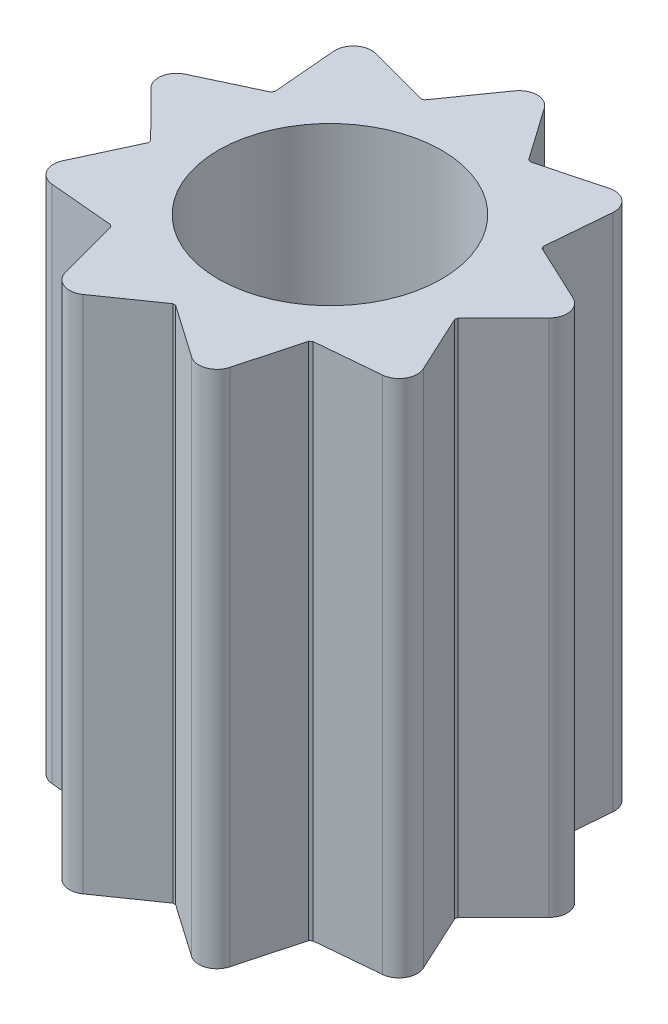
from build123d import *

# Parameters (mm, degrees)
SKETCH1_R           = 3
SKETCH1_R_2         = 2.15
BOSS_EXTRUDE1_DEPTH = 10
FILLET1_R           = 0.35


with BuildPart() as part:
    # Sketch1 → Boss-Extrude1 (new body)
    # profile 1 of 10: a face of its own
    with BuildSketch(Plane(origin=(0, 0, 0), x_dir=(1, 0, 0), z_dir=(0, 1, 0))):
        with BuildLine():
            Line((1, 2.828427125), (0, 4.25))
            Line((0, 4.25), (-1, 2.828427125))
            ThreePointArc((-1, 2.828427125), (0, 3), (1, 2.828427125))
        make_face()
    # profile 2 of 10: a face of its own
    with BuildSketch(Plane(origin=(0, 0, 0), x_dir=(1, 0, 0), z_dir=(0, 1, 0))):
        with BuildLine():
            Line((2.731847341, 3.255688883), (1.052033468, 2.809488491))
            ThreePointArc((1.052033468, 2.809488491), (1.928362829, 2.298133329), (2.584122354, 1.523913272))
            Line((2.584122354, 1.523913272), (2.731847341, 3.255688883))
        make_face()
    # profile 3 of 10: a face of its own
    with BuildSketch(Plane(origin=(0, 0, 0), x_dir=(1, 0, 0), z_dir=(0, 1, 0))):
        with BuildLine():
            Line((4.18543295, 0.738004755), (2.611808784, 1.475958969))
            ThreePointArc((2.611808784, 1.475958969), (2.901329553, 0.763077207), (3, 0))
            ThreePointArc((3, 0), (2.989758804, -0.24767376), (2.959105139, -0.493656537))
            Line((2.959105139, -0.493656537), (4.18543295, 0.738004755))
        make_face()
    # profile 4 of 10: a face of its own
    with BuildSketch(Plane(origin=(0, 0, 0), x_dir=(1, 0, 0), z_dir=(0, 1, 0))):
        with BuildLine():
            Line((3.680607966, -2.125), (2.949489743, -0.548188159))
            ThreePointArc((2.949489743, -0.548188159), (2.598076211, -1.5), (1.949489743, -2.280238966))
            Line((1.949489743, -2.280238966), (3.680607966, -2.125))
        make_face()
    # profile 5 of 10: a face of its own
    with BuildSketch(Plane(origin=(0, 0, 0), x_dir=(1, 0, 0), z_dir=(0, 1, 0))):
        with BuildLine():
            Line((1.453585609, -3.993693638), (1.907071671, -2.315831954))
            ThreePointArc((1.907071671, -2.315831954), (1.02606043, -2.819077862), (0.02768643, -2.999872241))
            Line((0.02768643, -2.999872241), (1.453585609, -3.993693638))
        make_face()
    # profile 6 of 10: a face of its own
    with BuildSketch(Plane(origin=(0, 0, 0), x_dir=(1, 0, 0), z_dir=(0, 1, 0))):
        with BuildLine():
            ThreePointArc((-0.02768643, -2.999872241), (-1.02606043, -2.819077862), (-1.907071671, -2.315831954))
            Line((-1.907071671, -2.315831954), (-1.453585609, -3.993693638))
            Line((-1.453585609, -3.993693638), (-0.02768643, -2.999872241))
        make_face()
    # profile 7 of 10: a face of its own
    with BuildSketch(Plane(origin=(0, 0, 0), x_dir=(1, 0, 0), z_dir=(0, 1, 0))):
        Circle(SKETCH1_R)
        with Locations(Location((0, 0, 0), (0, 0, 270))):
            Circle(SKETCH1_R_2, mode=Mode.SUBTRACT)
    # profile 8 of 10: a face of its own
    with BuildSketch(Plane(origin=(0, 0, 0), x_dir=(1, 0, 0), z_dir=(0, 1, 0))):
        with BuildLine():
            ThreePointArc((-1.949489743, -2.280238966), (-2.598076211, -1.5), (-2.949489743, -0.548188159))
            Line((-2.949489743, -0.548188159), (-3.680607966, -2.125))
            Line((-3.680607966, -2.125), (-1.949489743, -2.280238966))
        make_face()
    # profile 9 of 10: a face of its own
    with BuildSketch(Plane(origin=(0, 0, 0), x_dir=(1, 0, 0), z_dir=(0, 1, 0))):
        with BuildLine():
            ThreePointArc((-2.959105139, -0.493656537), (-2.954423259, 0.520944533), (-2.611808784, 1.475958969))
            Line((-2.611808784, 1.475958969), (-4.18543295, 0.738004755))
            Line((-4.18543295, 0.738004755), (-2.959105139, -0.493656537))
        make_face()
    # profile 10 of 10: a face of its own
    with BuildSketch(Plane(origin=(0, 0, 0), x_dir=(1, 0, 0), z_dir=(0, 1, 0))):
        with BuildLine():
            ThreePointArc((-2.584122354, 1.523913272), (-1.928362829, 2.298133329), (-1.052033468, 2.809488491))
            Line((-1.052033468, 2.809488491), (-2.731847341, 3.255688883))
            Line((-2.731847341, 3.255688883), (-2.584122354, 1.523913272))
        make_face()
    extrude(amount=BOSS_EXTRUDE1_DEPTH)

    # Fillet1
    fillet1_edges = [part.edges().sort_by_distance(p)[0] for p in [
        (0, 5, -4.25),
        (2.731847341, 5, -3.255688883),
        (4.18543295, 5, -0.738004755),
        (3.680607966, 5, 2.125),
        (1.453585609, 5, 3.993693638),
        (-1.453585609, 5, 3.993693638),
        (-3.680607966, 5, 2.125),
        (-4.18543295, 5, -0.738004755),
        (-2.731847341, 5, -3.255688883),
    ]]
    fillet(fillet1_edges, radius=FILLET1_R)


solid = part.part
